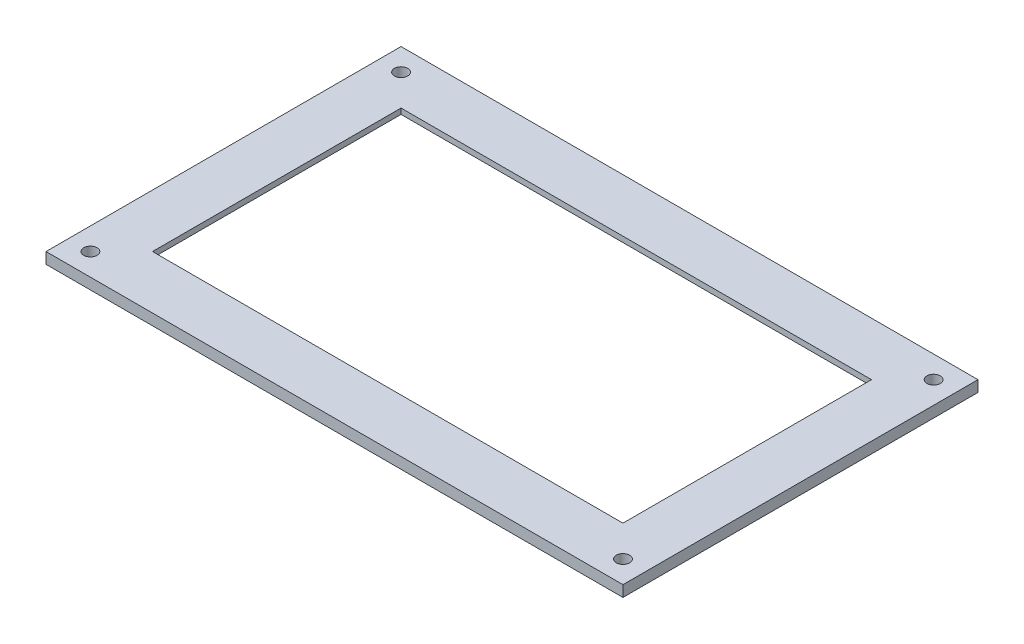
from build123d import *

# Parameters (mm, degrees)
SKETCH1_W           = 130
SKETCH1_H           = 80
BOSS_EXTRUDE1_DEPTH = 1.25
SKETCH2_W           = 110
SKETCH2_H           = 60
CUT_EXTRUDE1_DEPTH  = 153.648493278
SKETCH3_R           = 1.5
CUT_EXTRUDE2_DEPTH  = 153.648493278
SKETCH6_W           = 130
SKETCH6_H           = 80
SKETCH6_W_2         = 106
SKETCH6_H_2         = 56
BOSS_EXTRUDE2_DEPTH = 1.25
SKETCH7_R           = 1.5
CUT_EXTRUDE4_DEPTH  = 153.648493278


with BuildPart() as part:
    # Sketch1 → Boss-Extrude1 (new body)
    with BuildSketch(Plane(origin=(0, 0, 0), x_dir=(1, 0, 0), z_dir=(0, 1, 0))):
        with Locations((65, 40)):
            Rectangle(SKETCH1_W, SKETCH1_H)
    extrude(amount=BOSS_EXTRUDE1_DEPTH)

    # Sketch2 → Cut-Extrude1 (cut, through all)
    with BuildSketch(Plane.XZ):
        with Locations((65, -40)):
            Rectangle(SKETCH2_W, SKETCH2_H)
    extrude(amount=-CUT_EXTRUDE1_DEPTH, mode=Mode.SUBTRACT)

    # Sketch3 → Cut-Extrude2 (cut, through all)
    with BuildSketch(Plane(origin=(0, 1.25, 0), x_dir=(1, 0, 0), z_dir=(0, 1, 0))):
        with Locations(Location((5, 75, 0), (0, 0, 270))):
            Circle(SKETCH3_R)
        with Locations(Location((125, 75, 0), (0, 0, 270))):
            Circle(SKETCH3_R)
        with Locations(Location((125, 5, 0), (0, 0, 270))):
            Circle(SKETCH3_R)
        with Locations(Location((5, 5, 0), (0, 0, 270))):
            Circle(SKETCH3_R)
    extrude(amount=-CUT_EXTRUDE2_DEPTH, mode=Mode.SUBTRACT)

    # Sketch6 → Boss-Extrude2 (add)
    with BuildSketch(Plane(origin=(0, 1.25, 0), x_dir=(1, 0, 0), z_dir=(0, 1, 0))):
        with Locations((65, 40)):
            Rectangle(SKETCH6_W, SKETCH6_H)
        with Locations((65, 40)):
            Rectangle(SKETCH6_W_2, SKETCH6_H_2, mode=Mode.SUBTRACT)
    extrude(amount=BOSS_EXTRUDE2_DEPTH)

    # Sketch7 → Cut-Extrude4 (cut, through all)
    with BuildSketch(Plane.XZ.offset(-1.25)):
        with Locations(Location((5, -75, 0), (0, 0, 90))):
            Circle(SKETCH7_R)
        with Locations(Location((5, -5, 0), (0, 0, 90))):
            Circle(SKETCH7_R)
        with Locations(Location((125, -5, 0), (0, 0, 90))):
            Circle(SKETCH7_R)
        with Locations(Location((125, -75, 0), (0, 0, 90))):
            Circle(SKETCH7_R)
    extrude(amount=-CUT_EXTRUDE4_DEPTH, mode=Mode.SUBTRACT)


solid = part.part
